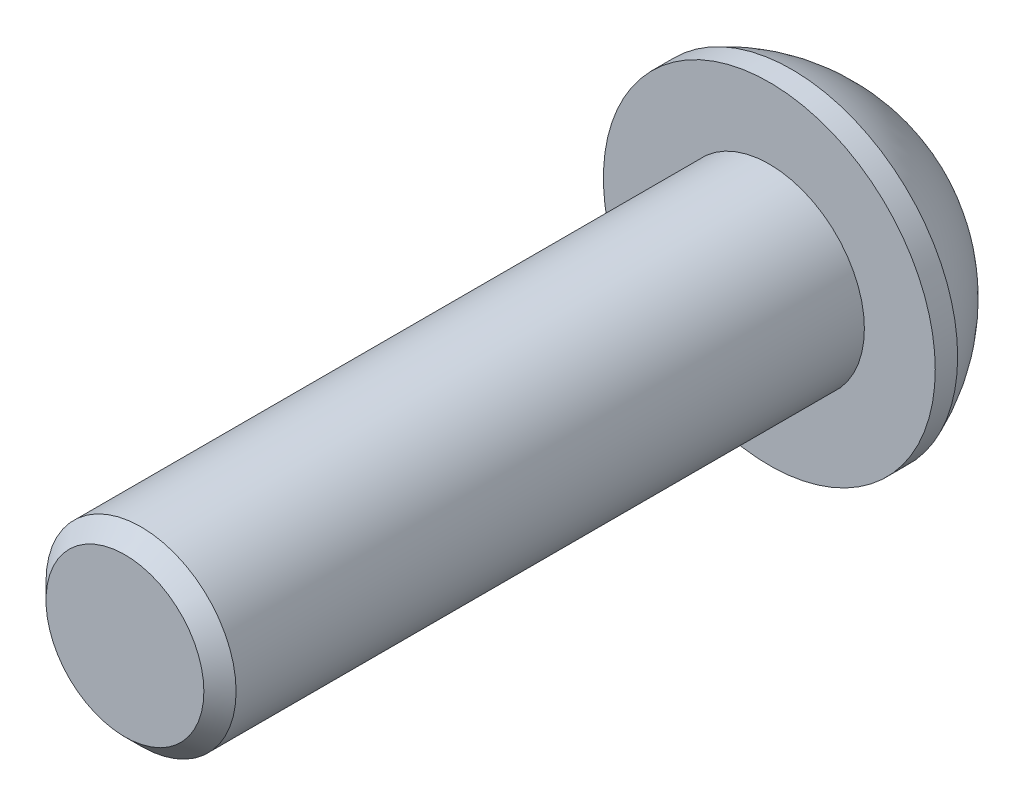
from build123d import *

# Parameters (mm, degrees)
SKIZZE1_R                       = 2.95
AUFSATZ_LINEAR_AUSTRAGEN1_DEPTH = 20
FASE1_SIZE                      = 0.5
SCHNITT_LINEAR_AUSTRAGEN1_DEPTH = 3


with BuildPart() as part:
    # Skizze1 → Aufsatz-Linear austragen1 (new body)
    with BuildSketch(Plane.XY):
        Circle(SKIZZE1_R)
    extrude(amount=AUFSATZ_LINEAR_AUSTRAGEN1_DEPTH)

    # Skizze2 → Rotation1 (revolve)
    with BuildSketch(Plane(origin=(0, 0, 0), x_dir=(0, 0, -1), z_dir=(1, 0, 0)), mode=Mode.PRIVATE) as rotation1_sk:
        with BuildLine():
            Line((3.25, 0), (3.25, 3.1))
            ThreePointArc((3.25, 3.1), (2.122398964, 4.311690857), (0.695193089, 5.15))
            Line((0.695193089, 5.15), (0, 5.15))
            Line((0, 5.15), (0, 0))
            Line((0, 0), (3.25, 0))
        make_face()
    revolve(rotation1_sk.sketch.rotate(Axis((0, 0, 0), (0, 0, -1)), 90), axis=Axis((0, 0, 0), (0, 0, -1)))

    # Fase1
    fase1_edges = [part.edges().sort_by_distance(p)[0] for p in [
        (-2.95, 0, 20),
    ]]
    chamfer(fase1_edges, length=FASE1_SIZE)

    # Skizze3 → Schnitt-Linear austragen1 (cut)
    with BuildSketch(Plane(origin=(0, 0, -3.25), x_dir=(-1, 0, 0), z_dir=(0, 0, -1))):
        Polygon((2, 1.154700538), (0, 2.309401077), (-2, 1.154700538), (-2, -1.154700538), (0, -2.309401077), (2, -1.154700538), align=None)
    extrude(amount=-SCHNITT_LINEAR_AUSTRAGEN1_DEPTH, mode=Mode.SUBTRACT)


solid = part.part
